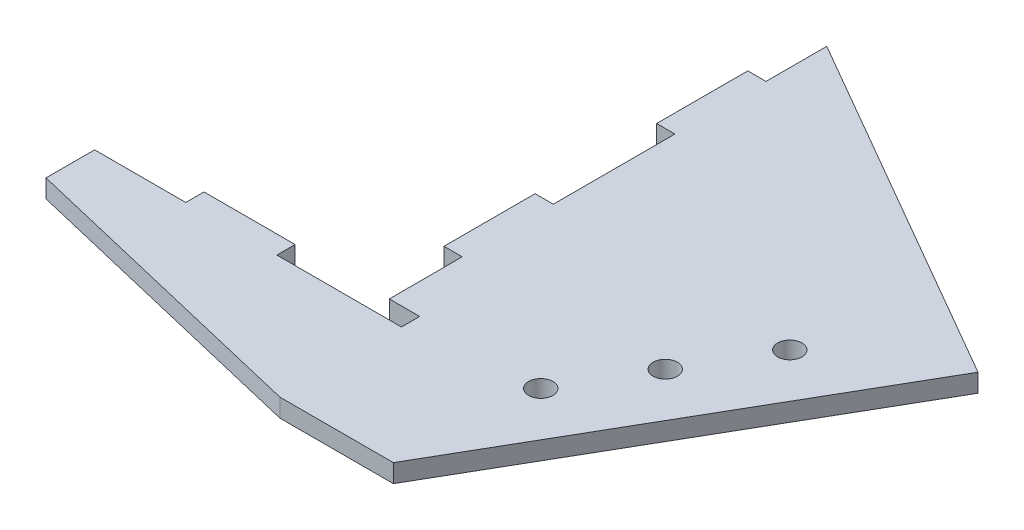
from build123d import *

# Parameters (mm, degrees)
SKETCH_1_W          = 15
SKETCH_1_H          = 3
SKETCH_1_W_2        = 3
SKETCH_1_H_2        = 15
EXTRUDE_1_DEPTH     = 3
SKETCH_2_R          = 2
CUT_EXTRUDE_1_DEPTH = 3


with BuildPart() as part:
    # 草图1 → 凸台-拉伸1 (new body)
    with BuildSketch(Plane(origin=(0, 0, 0), x_dir=(1, 0, 0), z_dir=(0, 1, 0))):
        Polygon((28, -21.5), (28, -1.5), (7.5, -1.5), (-7.5, -1.5), (-22.5, -1.5), align=None)
        Rectangle(SKETCH_1_W, SKETCH_1_H)
        with Locations((21.5, 21)):
            Rectangle(SKETCH_1_W_2, SKETCH_1_H_2)
        with Locations((21.5, 56)):
            Rectangle(SKETCH_1_W_2, SKETCH_1_H_2)
        Polygon((46.671361037, -21.5), (28, -21.5), (28, -1.5), (28, 1.5), (23, 1.5), (23, 13.5), (23, 28.5), (23, 48.5), (23, 63.5), (23, 73.5), (81.889727457, 39.5), align=None)
        Polygon((-22.5, -1.5), (-22.5, -9.5), (28, -21.5), align=None)
    extrude(amount=EXTRUDE_1_DEPTH)

    # 草图2 → 切除-拉伸1 (cut)
    with BuildSketch(Plane(origin=(0, 3, 0), x_dir=(1, 0, 0), z_dir=(0, 1, 0))):
        with Locations(Location((63.229473419, 27.179491924, 0), (0, 0, 270))):
            Circle(SKETCH_2_R)
        with Locations(Location((55.729473419, 14.189110868, 0), (0, 0, 270))):
            Circle(SKETCH_2_R)
        with Locations(Location((48.229473419, 1.198729811, 0), (0, 0, 270))):
            Circle(SKETCH_2_R)
    extrude(amount=-CUT_EXTRUDE_1_DEPTH, mode=Mode.SUBTRACT)


solid = part.part
